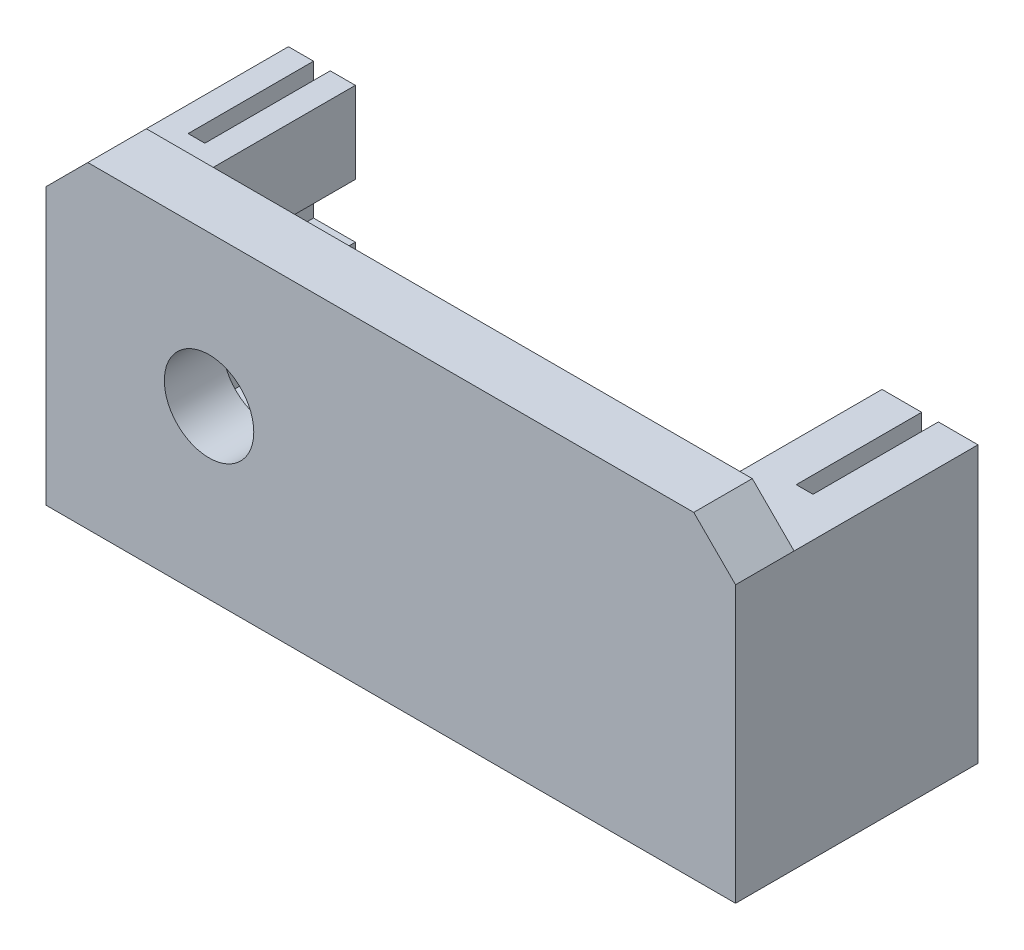
from build123d import *

# Parameters (mm, degrees)
SKETCH1_R           = 5.35
BOSS_EXTRUDE2_DEPTH = 7
SKETCH8_R           = 2
CUT_EXTRUDE2_DEPTH  = 2.25
BOSS_EXTRUDE3_DEPTH = 22
SKETCH10_W          = 82.482524805
SKETCH10_H          = 7
BOSS_EXTRUDE4_DEPTH = 5
CHAMFER1_SIZE       = 5
SKETCH11_W          = 28.790613911
SKETCH11_H          = 3
SKETCH11_W_2        = 32.450648491
CUT_EXTRUDE3_DEPTH  = 15


with BuildPart() as part:
    # Sketch1 → Boss-Extrude2 (new body)
    with BuildSketch(Plane.XY):
        Polygon((-19.503784034, 13), (-19.503784034, -20), (19.503784034, -20), (62.978740771, -20), (62.978740771, 13), (19.503784034, 13), align=None)
        Circle(SKETCH1_R, mode=Mode.SUBTRACT)
    extrude(amount=-BOSS_EXTRUDE2_DEPTH)

    # Sketch8 → Cut-Extrude2 (cut)
    with BuildSketch(Plane(origin=(0, 0, -7), x_dir=(-1, 0, 0), z_dir=(0, 0, -1))):
        with Locations((-11.35, 0)):
            Circle(SKETCH8_R)
    extrude(amount=-CUT_EXTRUDE2_DEPTH, mode=Mode.SUBTRACT)

    # Sketch9 → Boss-Extrude3 (add)
    with BuildSketch(Plane(origin=(0, 0, -7), x_dir=(-1, 0, 0), z_dir=(0, 0, -1))):
        Polygon((11.5, 3.25), (11.5, 13), (19.503784034, 13), (19.503784034, -12.662545792), (19.503784034, -20), (-56.5, -20), (-62.978740771, -20), (-62.978740771, 13), (-51.5, 13), (-51.5, 5), (-53.5, 5), (-53.5, -5), (-51.5, -5), (-51.5, -11.25), (11.5, -11.25), (11.5, -3.25), (16.5, -3.25), (16.5, 3.25), align=None)
    extrude(amount=BOSS_EXTRUDE3_DEPTH)

    # Sketch10 → Boss-Extrude4 (add)
    with BuildSketch(Plane(origin=(0, 13, 0), x_dir=(1, 0, 0), z_dir=(0, 1, 0))):
        with Locations((21.737478368, 3.5)):
            Rectangle(SKETCH10_W, SKETCH10_H)
    extrude(amount=BOSS_EXTRUDE4_DEPTH)

    # Chamfer1
    chamfer1_edges = [part.edges().sort_by_distance(p)[0] for p in [
        (62.978740771, 18, -3.5),
        (-19.503784034, 18, -3.5),
    ]]
    chamfer(chamfer1_edges, length=CHAMFER1_SIZE)

    # Sketch11 → Cut-Extrude3 (cut)
    with BuildSketch(Plane(origin=(0, 0, -29), x_dir=(-1, 0, 0), z_dir=(0, 0, -1))):
        Polygon((-60.239370385, 10), (-58.239370385, 10), (-58.239370385, 13), (-56.239370385, 13), (-56.239370385, 10), (-54.239370385, 10), (-54.239370385, 8), (-60.239370385, 8), align=None)
        with Locations((-45.84406343, -15.5)):
            Rectangle(SKETCH11_W, SKETCH11_H)
        with Locations((0.276567771, -15.5)):
            Rectangle(SKETCH11_W_2, SKETCH11_H)
        Polygon((14.501892017, 13), (16.501892017, 13), (16.501892017, 10), (18.501892017, 10), (18.501892017, 8), (12.501892017, 8), (12.501892017, 10), (14.501892017, 10), align=None)
    extrude(amount=-CUT_EXTRUDE3_DEPTH, mode=Mode.SUBTRACT)


solid = part.part
